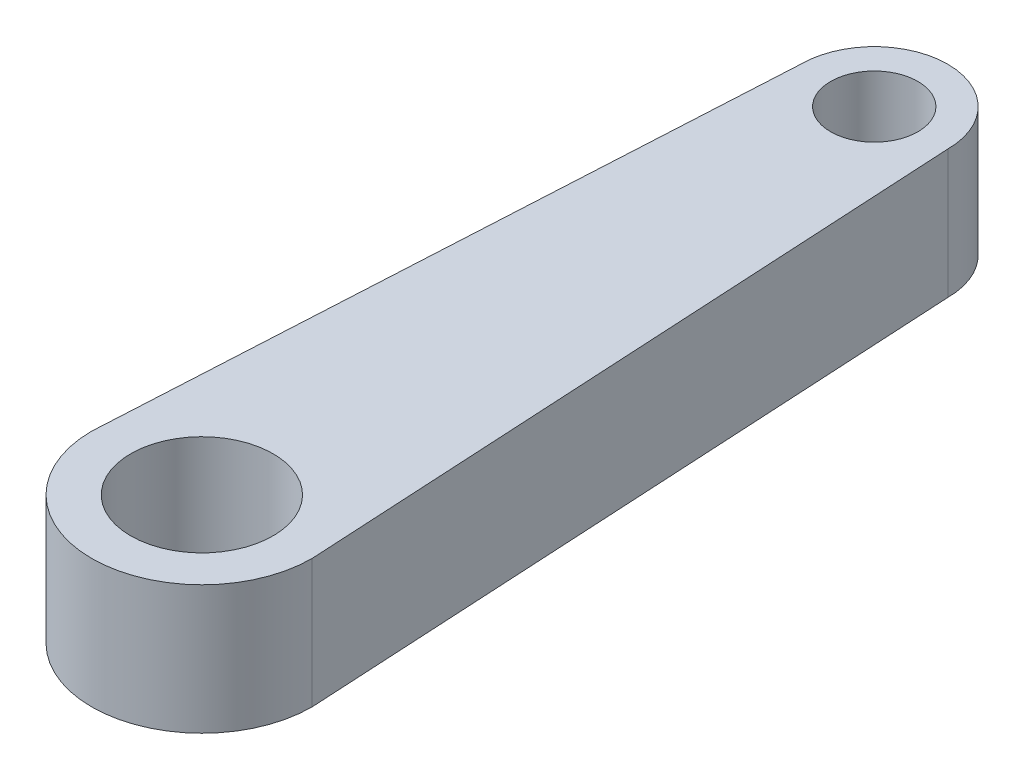
from build123d import *

# Parameters (mm, degrees)
SKETCH2_R           = 3.875
SKETCH2_R_2         = 2.375
BOSS_EXTRUDE1_DEPTH = 7


with BuildPart() as part:
    # Sketch2 → Boss-Extrude1 (new body)
    with BuildSketch(Plane(origin=(0, 0, 0), x_dir=(1, 0, 0), z_dir=(0, 1, 0))):
        with BuildLine():
            Line((-6, 0), (-4, 36.6))
            ThreePointArc((-4, 36.6), (0, 40.6), (4, 36.6))
            Line((4, 36.6), (6, 0))
            ThreePointArc((6, 0), (0, -6), (-6, 0))
        make_face()
        with Locations(Location((0, 0, 0), (0, 0, 270))):
            Circle(SKETCH2_R, mode=Mode.SUBTRACT)
        with Locations(Location((0, 36.6, 0), (0, 0, 270))):
            Circle(SKETCH2_R_2, mode=Mode.SUBTRACT)
    extrude(amount=BOSS_EXTRUDE1_DEPTH)


solid = part.part
